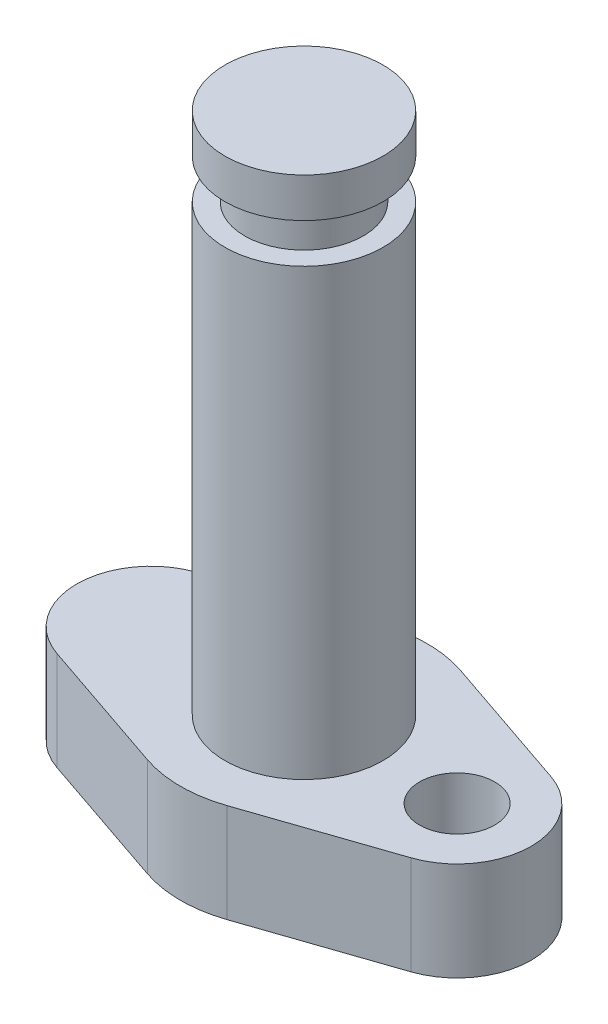
from build123d import *

# Parameters (mm, degrees)
SKETCH1_R                      = 6.25
SKETCH1_R_2                    = 3.75
SKETCH1_R_3                    = 2.5
BOSS_EXTRUDE1_DEPTH            = 5
SKETCH2_R                      = 4
BOSS_EXTRUDE2_DEPTH            = 22.5
SKETCH3_R                      = 3
BOSS_EXTRUDE3_DEPTH            = 2
SKETCH4_R                      = 4
BOSS_EXTRUDE4_DEPTH            = 2
SKETCH6_W                      = 1.89865
SKETCH6_H                      = 5
F_6_CLEARANCE_HOLE1_AT_2_COUNT = 2
F_6_CLEARANCE_HOLE1_AT_2_PITCH = 7.75


with BuildPart() as part:
    # Sketch1 → Boss-Extrude1 (new body)
    # profile 1 of 15: a face of its own
    with BuildSketch(Plane(origin=(0, 0, 0), x_dir=(1, 0, 0), z_dir=(0, 1, 0))):
        Circle(SKETCH1_R)
    # profile 2 of 15: a face of its own
    with BuildSketch(Plane(origin=(0, 0, 0), x_dir=(1, 0, 0), z_dir=(0, 1, 0))):
        with Locations((-7.75, 0)):
            Circle(SKETCH1_R_2)
        with Locations((-7.75, 0)):
            Circle(SKETCH1_R_3, mode=Mode.SUBTRACT)
    # profile 3 of 15: a face of its own
    with BuildSketch(Plane(origin=(0, 0, 0), x_dir=(1, 0, 0), z_dir=(0, 1, 0))):
        Circle(SKETCH1_R)
    # profile 4 of 15: a face of its own
    with BuildSketch(Plane(origin=(0, 0, 0), x_dir=(1, 0, 0), z_dir=(0, 1, 0))):
        with Locations((-7.75, 0)):
            Circle(SKETCH1_R_2)
        with Locations((-7.75, 0)):
            Circle(SKETCH1_R_3, mode=Mode.SUBTRACT)
    # profile 5 of 15: a face of its own
    with BuildSketch(Plane(origin=(0, 0, 0), x_dir=(1, 0, 0), z_dir=(0, 1, 0))):
        with Locations((7.75, 0)):
            Circle(SKETCH1_R_2)
    # profile 6 of 15: a face of its own
    with BuildSketch(Plane(origin=(0, 0, 0), x_dir=(1, 0, 0), z_dir=(0, 1, 0))):
        Circle(SKETCH1_R)
    # profile 7 of 15: a face of its own
    with BuildSketch(Plane(origin=(0, 0, 0), x_dir=(1, 0, 0), z_dir=(0, 1, 0))):
        with Locations((-7.75, 0)):
            Circle(SKETCH1_R_2)
    # profile 8 of 15: a face of its own
    with BuildSketch(Plane(origin=(0, 0, 0), x_dir=(1, 0, 0), z_dir=(0, 1, 0))):
        with BuildLine():
            ThreePointArc((-5.487903226, -2.990889196), (-7.15425073, -3.702375293), (-8.959677419, -3.54953244))
            Line((-8.959677419, -3.54953244), (-2.016129032, -5.9158874))
            ThreePointArc((-2.016129032, -5.9158874), (-4.026975125, -4.77974595), (-5.487903226, -2.990889196))
        make_face()
    # profile 9 of 15: a face of its own
    with BuildSketch(Plane(origin=(0, 0, 0), x_dir=(1, 0, 0), z_dir=(0, 1, 0))):
        with BuildLine():
            ThreePointArc((5.487903226, -2.990889196), (4.026975125, -4.77974595), (2.016129032, -5.9158874))
            Line((2.016129032, -5.9158874), (8.959677419, -3.54953244))
            ThreePointArc((8.959677419, -3.54953244), (7.15425073, -3.702375293), (5.487903226, -2.990889196))
        make_face()
    # profile 10 of 15: a face of its own
    with BuildSketch(Plane(origin=(0, 0, 0), x_dir=(1, 0, 0), z_dir=(0, 1, 0))):
        Circle(SKETCH1_R)
    # profile 11 of 15: a face of its own
    with BuildSketch(Plane(origin=(0, 0, 0), x_dir=(1, 0, 0), z_dir=(0, 1, 0))):
        with Locations((7.75, 0)):
            Circle(SKETCH1_R_2)
        with Locations((7.75, 0)):
            Circle(SKETCH1_R_3, mode=Mode.SUBTRACT)
    # profile 12 of 15: a face of its own
    with BuildSketch(Plane(origin=(0, 0, 0), x_dir=(1, 0, 0), z_dir=(0, 1, 0))):
        with Locations((7.75, 0)):
            Circle(SKETCH1_R_2)
        with Locations((7.75, 0)):
            Circle(SKETCH1_R_3, mode=Mode.SUBTRACT)
    # profile 13 of 15: a face of its own
    with BuildSketch(Plane(origin=(0, 0, 0), x_dir=(1, 0, 0), z_dir=(0, 1, 0))):
        Circle(SKETCH1_R)
    # profile 14 of 15: a face of its own
    with BuildSketch(Plane(origin=(0, 0, 0), x_dir=(1, 0, 0), z_dir=(0, 1, 0))):
        with BuildLine():
            Line((8.959677419, 3.54953244), (2.016129032, 5.9158874))
            ThreePointArc((2.016129032, 5.9158874), (4.026975125, 4.77974595), (5.487903226, 2.990889196))
            ThreePointArc((5.487903226, 2.990889196), (7.15425073, 3.702375293), (8.959677419, 3.54953244))
        make_face()
    # profile 15 of 15: a face of its own
    with BuildSketch(Plane(origin=(0, 0, 0), x_dir=(1, 0, 0), z_dir=(0, 1, 0))):
        with BuildLine():
            Line((-2.016129032, 5.9158874), (-8.959677419, 3.54953244))
            ThreePointArc((-8.959677419, 3.54953244), (-7.15425073, 3.702375293), (-5.487903226, 2.990889196))
            ThreePointArc((-5.487903226, 2.990889196), (-4.026975125, 4.77974595), (-2.016129032, 5.9158874))
        make_face()
    extrude(amount=BOSS_EXTRUDE1_DEPTH)

    # Sketch2 → Boss-Extrude2 (add)
    with BuildSketch(Plane(origin=(0, 5, 0), x_dir=(1, 0, 0), z_dir=(0, 1, 0))):
        with Locations(Location((0, 0, 0), (0, 0, 90))):
            Circle(SKETCH2_R)
    extrude(amount=BOSS_EXTRUDE2_DEPTH)

    # Sketch3 → Boss-Extrude3 (add)
    with BuildSketch(Plane(origin=(0, 27.5, 0), x_dir=(1, 0, 0), z_dir=(0, 1, 0))):
        with Locations(Location((0, 0, 0), (0, 0, 270))):
            Circle(SKETCH3_R)
    extrude(amount=BOSS_EXTRUDE3_DEPTH)

    # Sketch4 → Boss-Extrude4 (add)
    with BuildSketch(Plane(origin=(0, 29.5, 0), x_dir=(1, 0, 0), z_dir=(0, 1, 0))):
        with Locations(Location((0, 0, 0), (0, 0, 90))):
            Circle(SKETCH4_R)
    extrude(amount=BOSS_EXTRUDE4_DEPTH)

    # Sketch6 → #6 Clearance Hole1 (revolve, cut)
    with BuildSketch(Plane(origin=(7.75, 5, 0), x_dir=(0, 0, 1), z_dir=(1, 0, 0))):
        with Locations((0.949325, 2.5)):
            Rectangle(SKETCH6_W, SKETCH6_H)
    f_6_clearance_hole1 = revolve(axis=Axis((7.75, 11.35, 0), (0, -1, 0)), mode=Mode.SUBTRACT)

    # #6 Clearance Hole1 at 2: #6 Clearance Hole1 ×2
    with Locations(*[(-i * F_6_CLEARANCE_HOLE1_AT_2_PITCH, 0, 0) for i in range(1, F_6_CLEARANCE_HOLE1_AT_2_COUNT)]):
        add(f_6_clearance_hole1, mode=Mode.SUBTRACT)


solid = part.part
